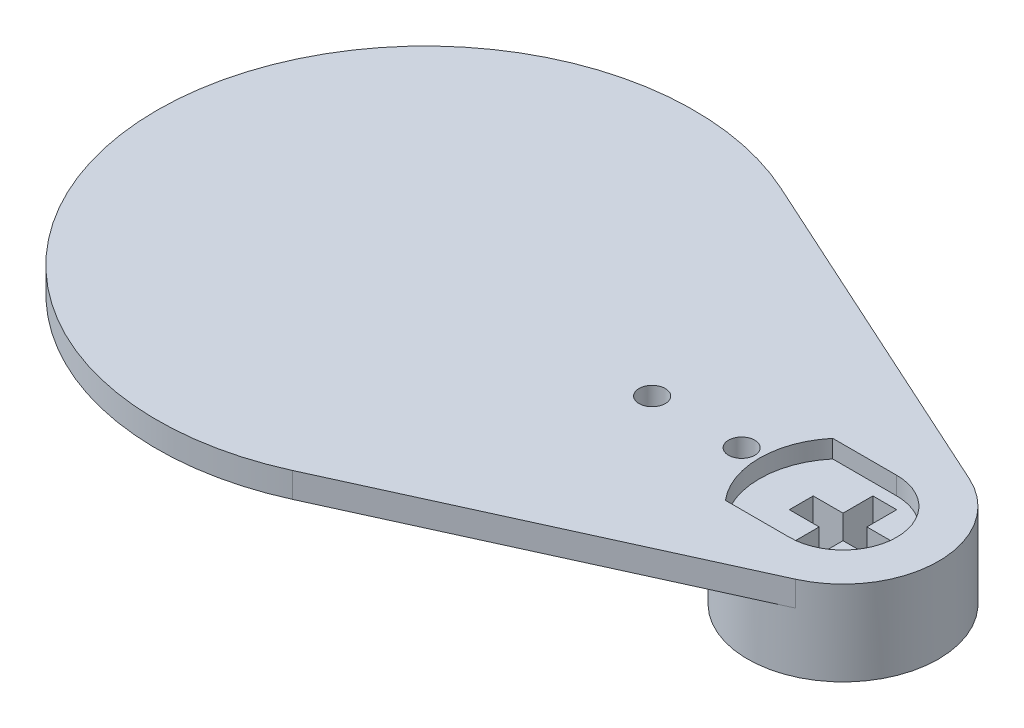
from build123d import *

# Parameters (mm, degrees)
SKETCH_1_R          = 1
EXTRUDE_1_DEPTH     = 2.1
CUT_EXTRUDE_2_DEPTH = 1.5
EXTRUDE_START       = 5
SKETCH_4_R          = 8
EXTRUDE_2_DEPTH     = 5
CUT_EXTRUDE_3_DEPTH = 63.152312909
SKETCH_2_R          = 1.1
CUT_EXTRUDE_1_DEPTH = 63.152312909
SKETCH_6_R          = 2.5
CUT_EXTRUDE_4_DEPTH = 5


with BuildPart() as part:
    # 草图1 → 凸台-拉伸1 (new body)
    with BuildSketch(Plane(origin=(0, 0, 0), x_dir=(1, 0, 0), z_dir=(0, 1, 0))):
        with BuildLine():
            Line((-25.678571429, 20.478304847), (3.314285714, 7.281175057))
            ThreePointArc((3.314285714, 7.281175057), (8, 0), (3.314285714, -7.281175057))
            Line((3.314285714, -7.281175057), (-25.678571429, -20.478304847))
            ThreePointArc((-25.678571429, -20.478304847), (-57.5, 0), (-25.678571429, 20.478304847))
        make_face()
        with Locations(Location((0, 0, 0), (0, 0, 270))):
            Circle(SKETCH_1_R, mode=Mode.SUBTRACT)
    extrude(amount=EXTRUDE_1_DEPTH)

    # 草图3 → 切除-拉伸2 (cut)
    with BuildSketch(Plane(origin=(0, 2.1, 0), x_dir=(1, 0, 0), z_dir=(0, 1, 0))):
        with BuildLine():
            Line((-5.361902647, 4.5), (0, 4.5))
            ThreePointArc((0, 4.5), (4.5, 0), (0, -4.5))
            Line((0, -4.5), (-5.361902647, -4.5))
            ThreePointArc((-5.361902647, -4.5), (-7, 0), (-5.361902647, 4.5))
        make_face()
    extrude(amount=-CUT_EXTRUDE_2_DEPTH, mode=Mode.SUBTRACT)

    # 草图4 → 凸台-拉伸2 (add)
    with BuildSketch(Plane.XZ.offset(EXTRUDE_START)):
        with Locations(Location((0, 0, 0), (0, 0, 270))):
            Circle(SKETCH_4_R)
    extrude(amount=-EXTRUDE_2_DEPTH)

    # 草图5 → 切除-拉伸3 (cut, through all)
    with BuildSketch(Plane.XZ.offset(5)):
        Polygon((1, -1), (1, -3.5), (-1, -3.5), (-1, -1), (-3.5, -1), (-3.5, 1), (-1, 1), (-1, 3.5), (1, 3.5), (1, 1), (3.5, 1), (3.5, -1), align=None)
    extrude(amount=-CUT_EXTRUDE_3_DEPTH, mode=Mode.SUBTRACT)

    # 草图2 → 切除-拉伸1 (cut, through all)
    with BuildSketch(Plane(origin=(0, 2.1, 0), x_dir=(1, 0, 0), z_dir=(0, 1, 0))):
        with Locations(Location((-8.5, 0, 0), (0, 0, 270))):
            Circle(SKETCH_2_R)
        with Locations(Location((-16, 0, 0), (0, 0, 270))):
            Circle(SKETCH_2_R)
    extrude(amount=-CUT_EXTRUDE_1_DEPTH, mode=Mode.SUBTRACT)

    # 草图6 → 切除-拉伸4 (cut)
    with BuildSketch(Plane.XZ.offset(5)):
        with Locations((-8.5, 0)):
            Circle(SKETCH_6_R)
    extrude(amount=-CUT_EXTRUDE_4_DEPTH, mode=Mode.SUBTRACT)


solid = part.part
